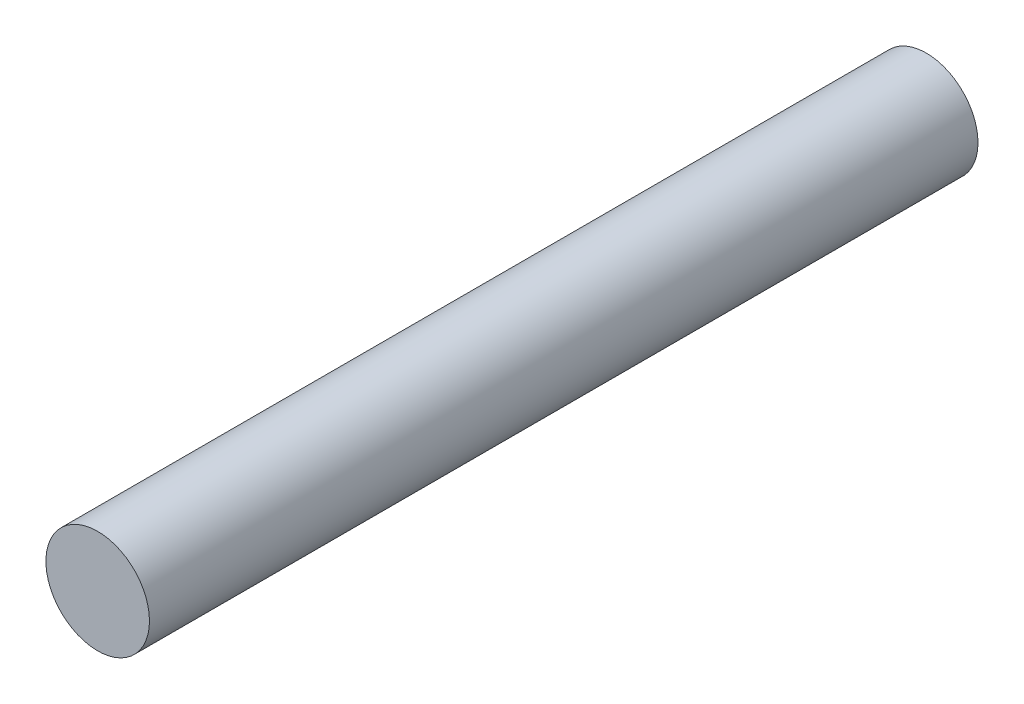
from build123d import *

# Parameters (mm, degrees)
SKETCH1_R           = 2.5
BOSS_EXTRUDE1_DEPTH = 20


with BuildPart() as part:
    # Sketch1 → Boss-Extrude1 (new, symmetric)
    with BuildSketch(Plane.XY):
        Circle(SKETCH1_R)
    extrude(amount=BOSS_EXTRUDE1_DEPTH, both=True)


solid = part.part
